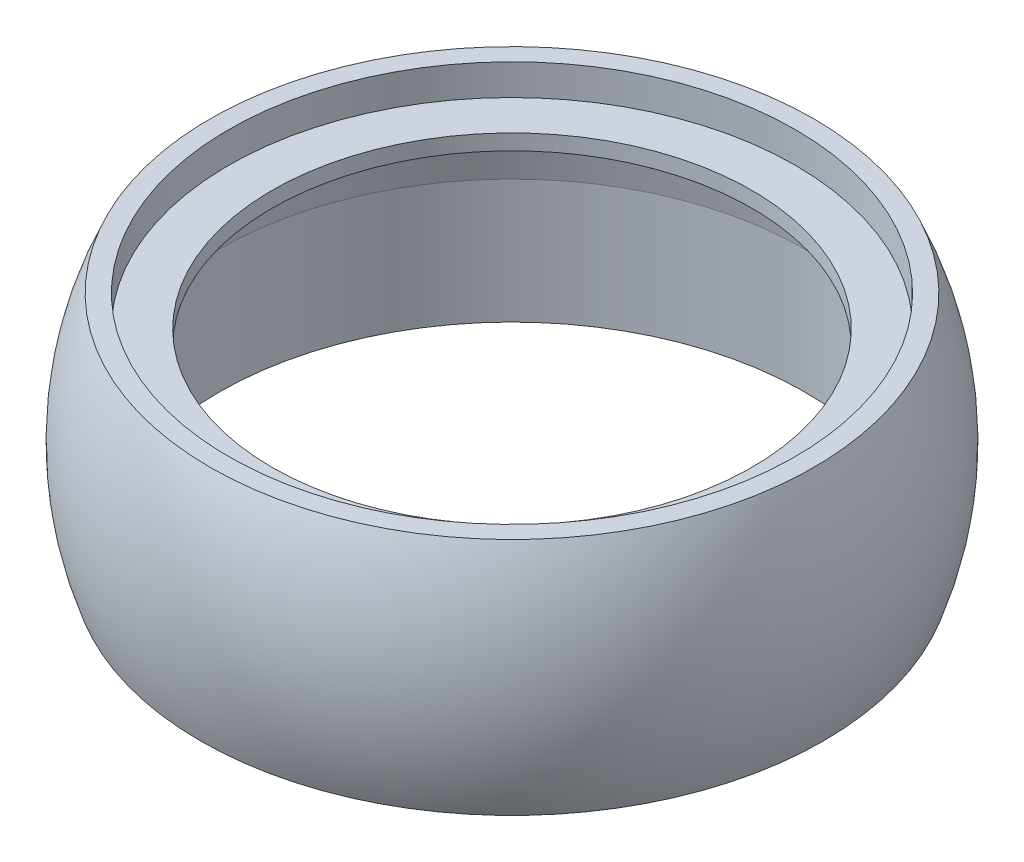
from build123d import *

# Parameters (mm, degrees)
SKETCH1_R           = 45.75
SKETCH1_R_2         = 38.75
BOSS_EXTRUDE1_DEPTH = 2.5
SKETCH3_R           = 48.75
SKETCH3_R_2         = 45.75
BOSS_EXTRUDE3_DEPTH = 5


with BuildPart() as part:
    # Sketch1 → Boss-Extrude1 (new body)
    with BuildSketch(Plane(origin=(0, 0, 0), x_dir=(1, 0, 0), z_dir=(0, 1, 0))):
        with Locations(Location((0, 0, 0), (0, 0, 270))):
            Circle(SKETCH1_R)
        with Locations(Location((0, 0, 0), (0, 0, 270))):
            Circle(SKETCH1_R_2, mode=Mode.SUBTRACT)
    extrude(amount=BOSS_EXTRUDE1_DEPTH)



with BuildPart() as body_2:
    # Sketch3 → Boss-Extrude3 (new body)
    with BuildSketch(Plane.XZ.offset(-2.5)):
        with Locations(Location((0, 0, 0), (0, 0, 270))):
            Circle(SKETCH3_R)
        with Locations(Location((0, 0, 0), (0, 0, 90))):
            Circle(SKETCH3_R_2, mode=Mode.SUBTRACT)
    extrude(amount=-BOSS_EXTRUDE3_DEPTH)


with BuildPart() as part_1:
    add(part.part)

    add(body_2.part)  # Revolve1 merges body 2
    # Sketch5 → Revolve1 (revolve)
    with BuildSketch(Plane.XY):
        Polygon((-45.8, 0), (-47.3, -10), (-47.3, -30), (-50.3, -30), (-50.3, -9.776251584), (-48.766809059, 0.445021359), (-48.766809059, 2.5), (-45.8, 2.5), (-45.73, 2.5), (-45.73, 0), align=None)
    revolve(axis=Axis((0, 0, 0), (0, -1, 0)))

    # Sketch8 → Revolve2 (revolve)
    with BuildSketch(Plane.XY, mode=Mode.PRIVATE) as revolve2_sk:
        with BuildLine():
            Line((-48.75, 7.5), (-48.75, 2.5))
            Line((-48.75, 2.5), (-48.766809059, 2.5))
            Line((-48.766809059, 2.5), (-48.766809059, 0.445021359))
            Line((-48.766809059, 0.445021359), (-50.3, -9.776251584))
            Line((-50.3, -9.776251584), (-50.3, -30))
            ThreePointArc((-50.3, -30), (-53.177120578, -11.099045683), (-48.75, 7.5))
        make_face()
    revolve(revolve2_sk.sketch.rotate(Axis((0, 0, 0), (0, 1, 0)), 270), axis=Axis((0, 0, 0), (0, 1, 0)))


solid = part_1.part
